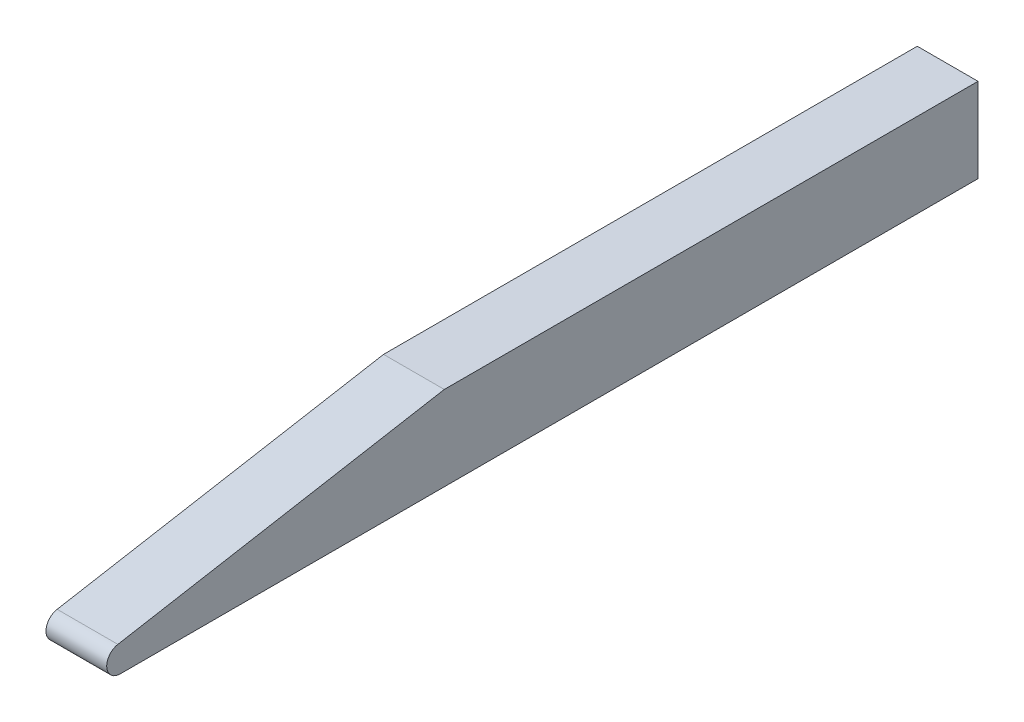
from build123d import *

# Parameters (mm, degrees)
BOSS_EXTRUDE1_DEPTH = 0.45
FILLET1_R           = 0.2


with BuildPart() as part:
    # Sketch1 → Boss-Extrude1 (new, symmetric)
    with BuildSketch(Plane(origin=(0, 0, 0), x_dir=(0, 0, -1), z_dir=(1, 0, 0))):
        Polygon((0, 0), (7.089102275, 1.25), (15, 1.25), (15, 0), align=None)
    extrude(amount=BOSS_EXTRUDE1_DEPTH, both=True)

    # Fillet1
    fillet1_edges = [part.edges().sort_by_distance(p)[0] for p in [
        (0, 0, 0),
    ]]
    fillet(fillet1_edges, radius=FILLET1_R)


solid = part.part
